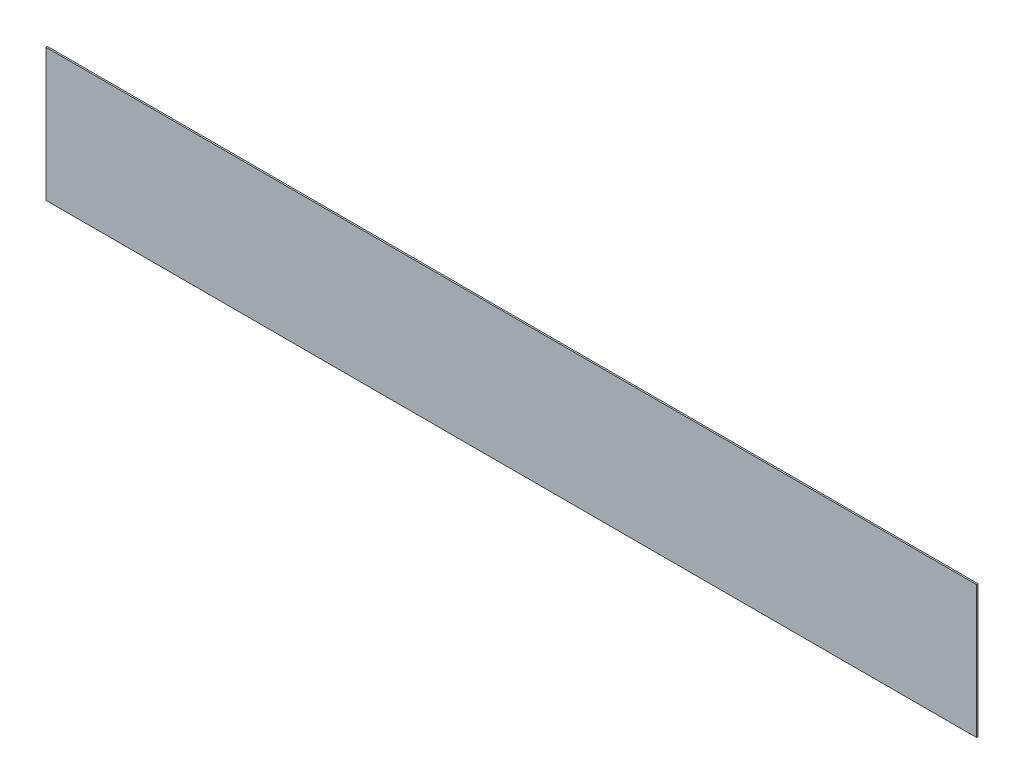
from build123d import *

# Parameters (mm, degrees)
SKETCH1_W                        = 618
SKETCH1_H                        = 88
CEK_DONMUS_ON_IC_SAC_1_0_1_DEPTH = 1


with BuildPart() as part:
    # Sketch1 → CEK_donmus_on_ic_sac_1.0_1 (new body)
    with BuildSketch(Plane.XY):
        with Locations((309, 44)):
            Rectangle(SKETCH1_W, SKETCH1_H)
    extrude(amount=CEK_DONMUS_ON_IC_SAC_1_0_1_DEPTH)


solid = part.part
